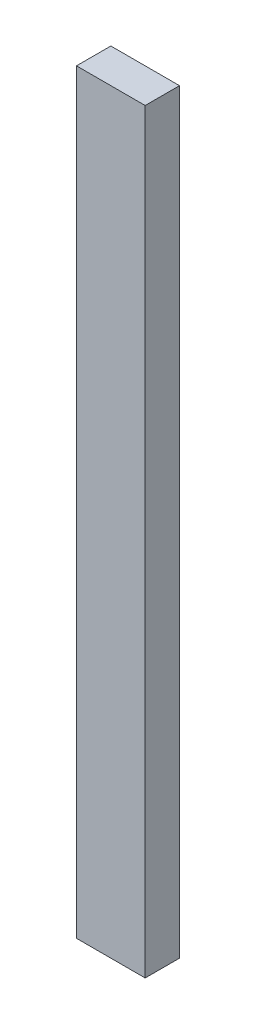
from build123d import *

# Parameters (mm, degrees)
SKETCH1_W           = 25.4
SKETCH1_H           = 279.4
BOSS_EXTRUDE1_DEPTH = 12.7


with BuildPart() as part:
    # Sketch1 → Boss-Extrude1 (new body)
    with BuildSketch(Plane.XY):
        Rectangle(SKETCH1_W, SKETCH1_H)
    extrude(amount=-BOSS_EXTRUDE1_DEPTH)


solid = part.part
